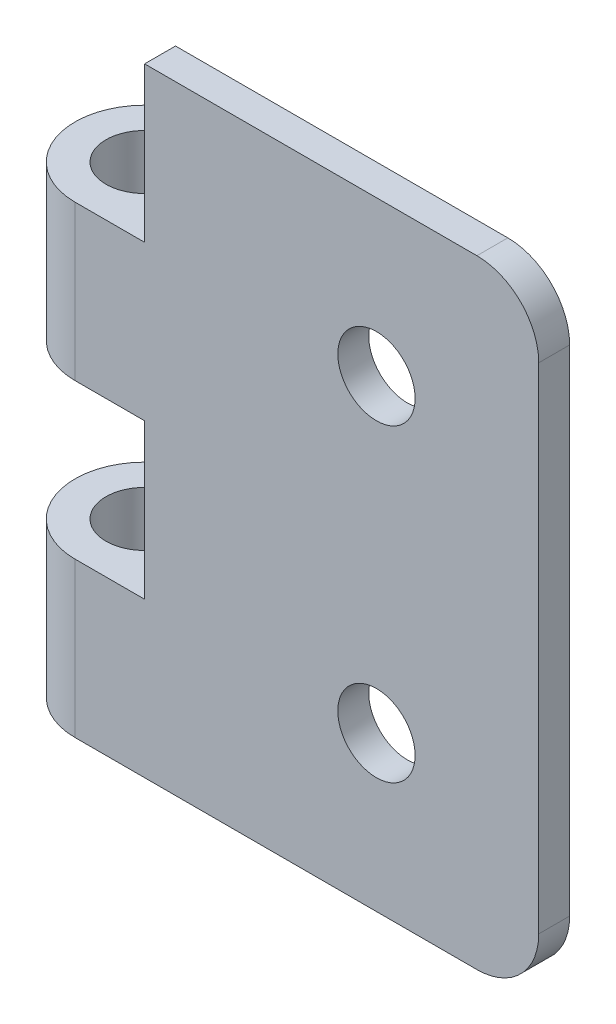
from build123d import *

# Parameters (mm, degrees)
SKETCH_1_R          = 2.5
EXTRUDE_1_DEPTH     = 40
CUT_EXTRUDE_1_REACH = 52.804
SKETCH_2_R          = 2.5
SKETCH_3_W          = 9
SKETCH_3_H          = 10
CUT_EXTRUDE_2_DEPTH = 20
FILLET_1_R          = 4


with BuildPart() as part:
    # 草图1 → 凸台-拉伸1 (new body)
    with BuildSketch(Plane(origin=(0, 0, 0), x_dir=(1, 0, 0), z_dir=(0, 1, 0))):
        with BuildLine():
            Line((0, -4.5), (30, -4.5))
            Line((30, -4.5), (30, -2.5))
            Line((30, -2.5), (3.741657387, -2.5))
            ThreePointArc((3.741657387, -2.5), (-2.121320344, 3.968626967), (0, -4.5))
        make_face()
        with Locations(Location((0, 0, 0), (0, 0, 270))):
            Circle(SKETCH_1_R, mode=Mode.SUBTRACT)
    extrude(amount=EXTRUDE_1_DEPTH)

    # 草图2 → 切除-拉伸1 (cut, up to next)
    with BuildSketch(Plane.XY.offset(4.5), mode=Mode.PRIVATE) as cut_extrude_1_sk1:
        with Locations((19.5, 30)):
            Circle(SKETCH_2_R)
    cut_extrude_1_tool1 = extrude(cut_extrude_1_sk1.sketch, amount=-CUT_EXTRUDE_1_REACH, mode=Mode.PRIVATE) & part.part
    # 草图2 → 切除-拉伸1 (cut, up to next)
    with BuildSketch(Plane.XY.offset(4.5), mode=Mode.PRIVATE) as cut_extrude_1_sk2:
        with Locations((19.5, 10)):
            Circle(SKETCH_2_R)
    cut_extrude_1_tool2 = extrude(cut_extrude_1_sk2.sketch, amount=-CUT_EXTRUDE_1_REACH, mode=Mode.PRIVATE) & part.part
    add(cut_extrude_1_tool1.solids().sort_by_distance((19.5, 30, 4.5))[0], mode=Mode.SUBTRACT)
    add(cut_extrude_1_tool2.solids().sort_by_distance((19.5, 10, 4.5))[0], mode=Mode.SUBTRACT)

    # 草图3 → 切除-拉伸2 (cut, symmetric)
    with BuildSketch(Plane(origin=(0, 0, 2.5), x_dir=(-1, 0, 0), z_dir=(0, 0, -1))):
        with Locations((0, 35)):
            Rectangle(SKETCH_3_W, SKETCH_3_H)
        with Locations((0, 15)):
            Rectangle(SKETCH_3_W, SKETCH_3_H)
    extrude(amount=CUT_EXTRUDE_2_DEPTH, both=True, mode=Mode.SUBTRACT)

    # 圆角1
    fillet_1_edges = [part.edges().sort_by_distance(p)[0] for p in [
        (30, 40, 3.5),
        (30, 0, 3.5),
    ]]
    fillet(fillet_1_edges, radius=FILLET_1_R)


solid = part.part
